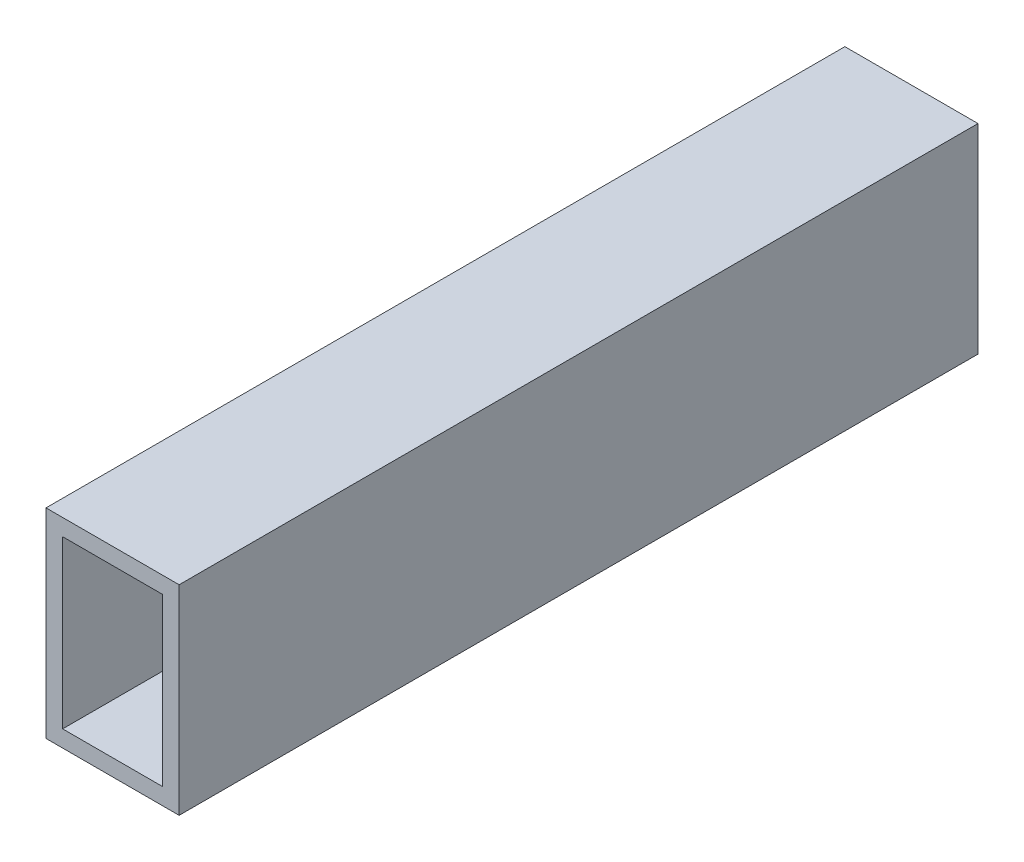
from build123d import *

# Parameters (mm, degrees)
SKETCH1_W           = 25.4
SKETCH1_H           = 38.1
SKETCH1_W_2         = 19.05
SKETCH1_H_2         = 31.75
BOSS_EXTRUDE1_DEPTH = 152.4


with BuildPart() as part:
    # Sketch1 → Boss-Extrude1 (new body)
    with BuildSketch(Plane.XY):
        Rectangle(SKETCH1_W, SKETCH1_H)
        Rectangle(SKETCH1_W_2, SKETCH1_H_2, mode=Mode.SUBTRACT)
    extrude(amount=BOSS_EXTRUDE1_DEPTH)


solid = part.part
